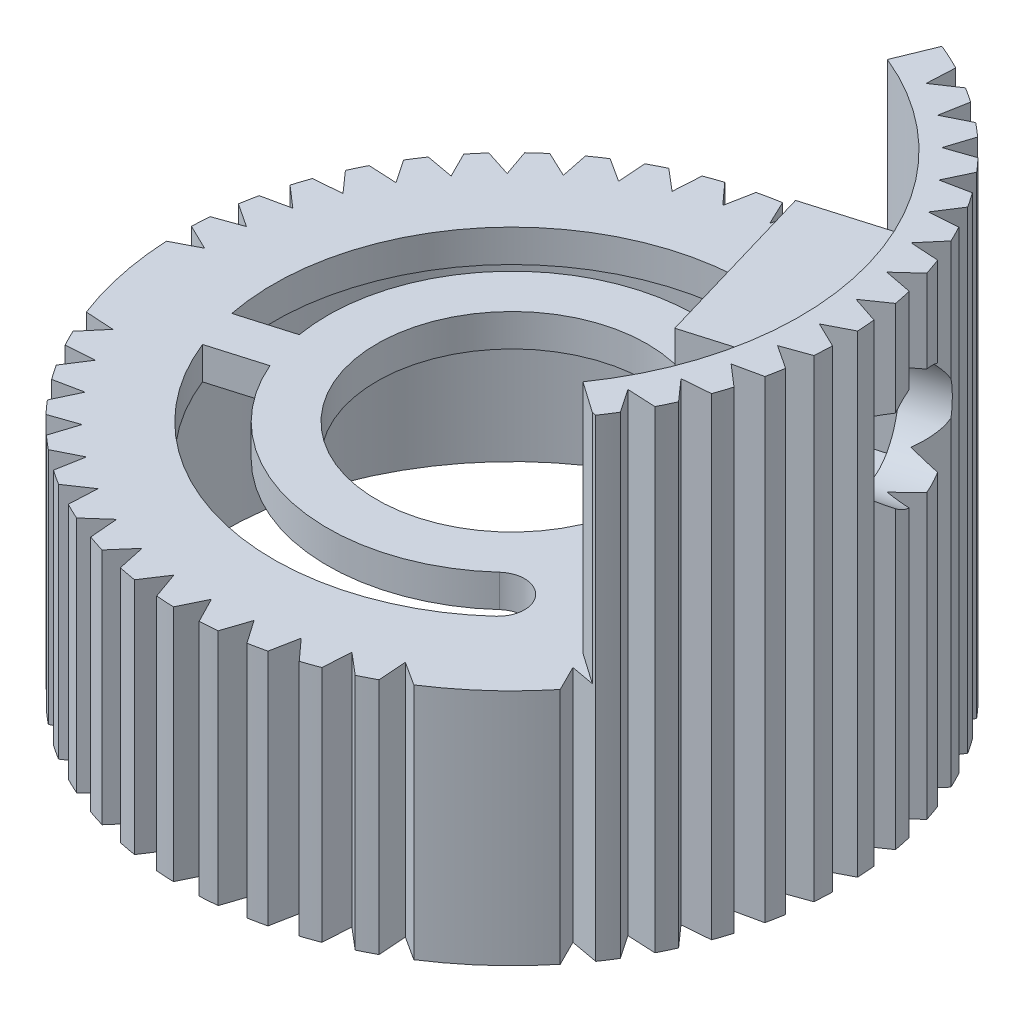
from build123d import *

# Parameters (mm, degrees)
SKETCH1_R                             = 26.631966011
BOSS_EXTRUDE1_DEPTH                   = 45.77
SKETCH3_R                             = 5
CUT_EXTRUDE1_DEPTH                    = 28.64
SKETCH9_W                             = 16.5
SKETCH9_H                             = 18.25
SKETCH9_W_2                           = 13.5
SKETCH9_H_2                           = 15.25
BOSS_EXTRUDE8_DEPTH                   = 10
BOSS_EXTRUDE9_START                   = 3
SKETCH11_R                            = 26.631966011
SKETCH11_R_2                          = 12.5
BOSS_EXTRUDE9_DEPTH                   = 3
CUT_EXTRUDE2_DEPTH                    = 57
CUT_EXTRUDE3_DEPTH                    = 57
BOSS_EXTRUDE11_REACH                  = 76.412
BOSS_EXTRUDE11_END_RADIUS             = 22.065
SKETCH14_W                            = 4
SKETCH14_H                            = 3
BOSS_EXTRUDE11_DIRECTION_2_REACH      = 76.412
BOSS_EXTRUDE11_DIRECTION_2_END_RADIUS = 17.065
SKETCH16_R                            = 53.532078291
CUT_EXTRUDE5_DEPTH                    = 2


with BuildPart() as part:
    # Sketch1 → Boss-Extrude1 (new body)
    with BuildSketch(Plane(origin=(0, 0, 0), x_dir=(1, 0, 0), z_dir=(0, 1, 0))):
        with BuildLine():
            Line((-3.984261156, 27.848398027), (-3.155526874, 30.336328812))
            ThreePointArc((-3.155526874, 30.336328812), (-2.335703763, 30.410437264), (-1.5141793, 30.462394497))
            Line((-1.5141793, 30.462394497), (-0.315230151, 28.130201914))
            Line((-0.315230151, 28.130201914), (0.831154566, 30.48867707))
            ThreePointArc((0.831154566, 30.48867707), (1.65363686, 30.455143124), (2.474914637, 30.399425407))
            Line((2.474914637, 30.399425407), (3.359194573, 27.930690283))
            Line((3.359194573, 27.930690283), (4.803614875, 30.119355554))
            ThreePointArc((4.803614875, 30.119355554), (9.479661295, 28.989418191), (13.919878882, 27.138300594))
            Line((13.919878882, 27.138300594), (13.792102919, 24.51908612))
            Line((13.792102919, 24.51908612), (15.964140245, 25.988394149))
            ThreePointArc((15.964140245, 25.988394149), (16.659663243, 25.548112068), (17.343051232, 25.089220567))
            Line((17.343051232, 25.089220567), (16.874492259, 22.509091617))
            Line((16.874492259, 22.509091617), (19.21973095, 23.682321883))
            ThreePointArc((19.21973095, 23.682321883), (19.851835217, 23.155022565), (20.469479277, 22.610856977))
            Line((20.469479277, 22.610856977), (19.668154402, 20.113960352))
            Line((19.668154402, 20.113960352), (22.146466743, 20.971038467))
            ThreePointArc((22.146466743, 20.971038467), (22.704336831, 20.365744156), (23.245668935, 19.745615304))
            Line((23.245668935, 19.745615304), (22.125289014, 17.374673686))
            Line((22.125289014, 17.374673686), (24.69427034, 17.900934736))
            ThreePointArc((24.69427034, 17.900934736), (25.168360968, 17.228002177), (25.624118803, 16.542520632))
            Line((25.624118803, 16.542520632), (24.203853841, 14.338101571))
            Line((24.203853841, 14.338101571), (26.8195481, 14.52454104))
            ThreePointArc((26.8195481, 14.52454104), (27.201747469, 13.795484281), (27.564132913, 13.056378805))
            Line((27.564132913, 13.056378805), (25.868284062, 11.0562006))
            Line((25.868284062, 11.0562006), (28.485935925, 10.899628442))
            ThreePointArc((28.485935925, 10.899628442), (28.769704511, 10.126921824), (29.032517063, 9.346838694))
            Line((29.032517063, 9.346838694), (27.090100815, 7.585125008))
            Line((27.090100815, 7.585125008), (29.664921456, 7.088220232))
            ThreePointArc((29.664921456, 7.088220232), (29.845403904, 6.285084953), (30.00414677, 5.47737158))
            Line((30.00414677, 5.47737158), (27.848398476, 3.984265861))
            Line((27.848398476, 3.984265861), (30.336331931, 3.15553069))
            ThreePointArc((30.336331931, 3.15553069), (30.410440131, 2.33570859), (30.462397167, 1.514185147))
            Line((30.462397167, 1.514185147), (28.130202362, 0.315234856))
            Line((28.130202362, 0.315234856), (30.488679348, -0.83115075))
            ThreePointArc((30.488679348, -0.83115075), (30.455145268, -1.653632314), (30.399427457, -2.474909359))
            Line((30.399427457, -2.474909359), (27.930690731, -3.359189868))
            Line((27.930690731, -3.359189868), (30.11935702, -4.803610841))
            ThreePointArc((30.11935702, -4.803610841), (29.97875441, -5.614679004), (29.81631507, -6.421657392))
            Line((29.81631507, -6.421657392), (27.253277282, -6.976137886))
            Line((27.253277282, -6.976137886), (29.234684181, -8.693879674))
            ThreePointArc((29.234684181, -8.693879674), (28.989418755, -9.479656851), (28.723037229, -10.258528973))
            Line((28.723037229, -10.258528973), (26.109552746, -10.473722214))
            Line((26.109552746, -10.473722214), (27.849797859, -12.435393664))
            ThreePointArc((27.849797859, -12.435393664), (27.504066132, -13.182434995), (27.138300238, -13.919874138))
            Line((27.138300238, -13.919874138), (24.519086569, -13.792098214))
            Line((24.519086569, -13.792098214), (25.988393872, -15.964134468))
            ThreePointArc((25.988393872, -15.964134468), (25.548111361, -16.659657866), (25.089219408, -17.343046235))
            Line((25.089219408, -17.343046235), (22.509092066, -16.874487554))
            Line((22.509092066, -16.874487554), (23.682321388, -19.219724361))
            ThreePointArc((23.682321388, -19.219724361), (20.365742572, -22.704330231), (16.542517807, -25.624111989))
            Line((16.542517807, -25.624111989), (14.33810202, -24.203849136))
            Line((14.33810202, -24.203849136), (14.524541185, -26.819539129))
            ThreePointArc((14.524541185, -26.819539129), (13.795482869, -27.201739208), (13.056375797, -27.564125279))
            Line((13.056375797, -27.564125279), (11.056201049, -25.868279357))
            Line((11.056201049, -25.868279357), (10.899629182, -28.485926359))
            ThreePointArc((10.899629182, -28.485926359), (10.126920725, -28.76969554), (9.346835723, -29.032508588))
            Line((9.346835723, -29.032508588), (7.585125457, -27.09009611))
            Line((7.585125457, -27.09009611), (7.0882217, -29.66491147))
            ThreePointArc((7.0882217, -29.66491147), (6.285084339, -29.845394329), (5.477368862, -30.004137493))
            Line((5.477368862, -30.004137493), (3.984266309, -27.848393771))
            Line((3.984266309, -27.848393771), (3.15553297, -30.336321728))
            ThreePointArc((3.15553297, -30.336321728), (2.3357086, -30.410430097), (1.51418288, -30.462387181))
            Line((1.51418288, -30.462387181), (0.315235305, -28.130197658))
            Line((0.315235305, -28.130197658), (-0.831147629, -30.488669145))
            ThreePointArc((-0.831147629, -30.488669145), (-1.653631581, -30.455134954), (-2.474911005, -30.399416902))
            Line((-2.474911005, -30.399416902), (-3.35918942, -27.930686027))
            Line((-3.35918942, -27.930686027), (-4.803606908, -30.119347035))
            ThreePointArc((-4.803606908, -30.119347035), (-5.614677501, -29.978744012), (-6.421658293, -29.816304126))
            Line((-6.421658293, -29.816304126), (-6.976137437, -27.253272577))
            Line((-6.976137437, -27.253272577), (-8.693875013, -29.234674617))
            ThreePointArc((-8.693875013, -29.234674617), (-9.479654581, -28.989408474), (-10.258529053, -28.723026103))
            Line((-10.258529053, -28.723026103), (-10.473721765, -26.109548042))
            Line((-10.473721765, -26.109548042), (-12.435388408, -27.84978889))
            ThreePointArc((-12.435388408, -27.84978889), (-13.182432016, -27.504056163), (-13.919873378, -27.138289149))
            Line((-13.919873378, -27.138289149), (-13.792097766, -24.519081864))
            Line((-13.792097766, -24.519081864), (-15.964128792, -25.988385631))
            ThreePointArc((-15.964128792, -25.988385631), (-16.659654283, -25.548101878), (-17.343044673, -25.089208572))
            Line((-17.343044673, -25.089208572), (-16.874487106, -22.509087361))
            Line((-16.874487106, -22.509087361), (-19.219718467, -23.68231396))
            ThreePointArc((-19.219718467, -23.68231396), (-19.851825173, -23.155012543), (-20.469471557, -22.610844724))
            Line((-20.469471557, -22.610844724), (-19.668149248, -20.113956096))
            Line((-19.668149248, -20.113956096), (-22.146453419, -20.971031386))
            ThreePointArc((-22.146453419, -20.971031386), (-22.704325784, -20.365734574), (-23.245660027, -19.745603103))
            Line((-23.245660027, -19.745603103), (-22.125283861, -17.374669429))
            Line((-22.125283861, -17.374669429), (-24.694256422, -17.900928684))
            ThreePointArc((-24.694256422, -17.900928684), (-25.168349066, -17.227993282), (-25.62410876, -16.542508787))
            Line((-25.62410876, -16.542508787), (-24.203848687, -14.338097315))
            Line((-24.203848687, -14.338097315), (-26.819533875, -14.524536138))
            ThreePointArc((-26.819533875, -14.524536138), (-27.201734918, -13.79547627), (-27.564121868, -13.056367599))
            Line((-27.564121868, -13.056367599), (-25.868278909, -11.056196344))
            Line((-25.868278909, -11.056196344), (-28.4859217, -10.899624729))
            ThreePointArc((-28.4859217, -10.899624729), (-29.845390828, -6.285079097), (-30.462384511, -1.514177033))
            Line((-30.462384511, -1.514177033), (-28.130197209, -0.3152306))
            Line((-28.130197209, -0.3152306), (-30.488666867, 0.831151445))
            ThreePointArc((-30.488666867, 0.831151445), (-30.455132809, 1.653636127), (-30.399414852, 2.474916284))
            Line((-30.399414852, 2.474916284), (-27.930685578, 3.359194124))
            Line((-27.930685578, 3.359194124), (-30.119345569, 4.803610941))
            ThreePointArc((-30.119345569, 4.803610941), (-29.978742638, 5.614681962), (-29.816302822, 6.421663183))
            Line((-29.816302822, 6.421663183), (-27.253272129, 6.976142142))
            Line((-27.253272129, 6.976142142), (-29.23467388, 8.693879467))
            ThreePointArc((-29.23467388, 8.693879467), (-28.989407866, 9.479659161), (-28.72302562, 10.258533761))
            Line((-28.72302562, 10.258533761), (-26.109547593, 10.47372647))
            Line((-26.109547593, 10.47372647), (-27.849788746, 12.435393457))
            ThreePointArc((-27.849788746, 12.435393457), (-27.504056265, 13.182436908), (-27.138289505, 13.919878122))
            Line((-27.138289505, 13.919878122), (-24.519081415, 13.792102471))
            Line((-24.519081415, 13.792102471), (-25.988385908, 15.964134569))
            ThreePointArc((-25.988385908, 15.964134569), (-25.548102584, 16.65965966), (-25.089209731, 17.34304967))
            Line((-25.089209731, 17.34304967), (-22.509086912, 16.87449181))
            Line((-22.509086912, 16.87449181), (-23.682314454, 19.219725057))
            ThreePointArc((-23.682314454, 19.219725057), (-23.155013707, 19.851831175), (-22.610846592, 20.469477005))
            Line((-22.610846592, 20.469477005), (-20.113955647, 19.668153953))
            Line((-20.113955647, 19.668153953), (-20.97103188, 22.14646085))
            ThreePointArc((-20.97103188, 22.14646085), (-20.36573602, 22.704332508), (-19.745605539, 23.245666095))
            Line((-19.745605539, 23.245666095), (-17.374668981, 22.125288565))
            Line((-17.374668981, 22.125288565), (-17.90092896, 24.694264665))
            ThreePointArc((-17.90092896, 24.694264665), (-17.227994811, 25.168356561), (-16.542511612, 25.624115574))
            Line((-16.542511612, 25.624115574), (-14.338096867, 24.203853392))
            Line((-14.338096867, 24.203853392), (-14.524535993, 26.819542846))
            ThreePointArc((-14.524535993, 26.819542846), (-13.795477682, 27.20174318), (-13.056370606, 27.564129503))
            Line((-13.056370606, 27.564129503), (-11.056195896, 25.868283613))
            Line((-11.056195896, 25.868283613), (-10.89962399, 28.485931265))
            ThreePointArc((-10.89962399, 28.485931265), (-10.126915935, 28.769700534), (-9.346831335, 29.032513688))
            Line((-9.346831335, 29.032513688), (-7.585120303, 27.090100366))
            Line((-7.585120303, 27.090100366), (-7.088216199, 29.664917524))
            ThreePointArc((-7.088216199, 29.664917524), (-6.06936901, 29.890013635), (-5.043418528, 30.08012798))
            Line((-5.043418528, 30.08012798), (-3.984261156, 27.848398027))
        make_face()
        with Locations(Location((2.577e-06, 2.128e-06, 0), (0, 0, 270))):
            Circle(SKETCH1_R, mode=Mode.SUBTRACT)
    extrude(amount=BOSS_EXTRUDE1_DEPTH)

    # Sketch3 → Cut-Extrude1 (cut)
    with BuildSketch(Plane(origin=(35.495871095, 0, -10.442392938), x_dir=(-0.28222679131648654, 0, -0.9593477149934744), z_dir=(0.9593477149934744, 0, -0.28222679131648654))):
        with Locations((1.938e-06, 33.1475)):
            Circle(SKETCH3_R)
    extrude(amount=-CUT_EXTRUDE1_DEPTH, mode=Mode.SUBTRACT)

    # Sketch9 → Boss-Extrude8 (add)
    with BuildSketch(Plane(origin=(25.549318686, 0, -7.516255181), x_dir=(0.2822267913164864, 0, 0.9593477149934744), z_dir=(-0.9593477149934744, 0, 0.2822267913164864))):
        with Locations((-1.938e-06, 33.1475)):
            Rectangle(SKETCH9_W, SKETCH9_H)
        with Locations((-1.938e-06, 33.1475)):
            Rectangle(SKETCH9_W_2, SKETCH9_H_2, mode=Mode.SUBTRACT)
    extrude(amount=BOSS_EXTRUDE8_DEPTH)

    # Sketch11 → Boss-Extrude9 (add)
    with BuildSketch(Plane.XZ.offset(-24.0225).offset(BOSS_EXTRUDE9_START)):
        with Locations(Location((2.577e-06, -2.128e-06, 0), (0, 0, 325.560988293))):
            Circle(SKETCH11_R)
        with Locations(Location((2.577e-06, -2.128e-06, 0), (0, 0, 270))):
            Circle(SKETCH11_R_2, mode=Mode.SUBTRACT)
    extrude(amount=-BOSS_EXTRUDE9_DEPTH)

    # Sketch12 → Cut-Extrude2 (cut)
    with BuildSketch(Plane(origin=(0, 24.0225, 0), x_dir=(1, 0, 0), z_dir=(0, 1, 0))):
        with BuildLine():
            Line((2.577e-06, 2.128e-06), (10.085527594, 24.648405702))
            Line((10.085527594, 24.648405702), (17.346679097, 42.394213914))
            ThreePointArc((17.346679097, 42.394213914), (-43.943740033, -12.927637435), (37.540058708, -26.247294207))
            Line((37.540058708, -26.247294207), (21.826153241, -15.260429085))
            Line((21.826153241, -15.260429085), (2.577e-06, 2.128e-06))
        make_face()
    extrude(amount=CUT_EXTRUDE2_DEPTH, mode=Mode.SUBTRACT)

    # Sketch13 → Cut-Extrude3 (cut)
    with BuildSketch(Plane(origin=(0, 24.0225, 0), x_dir=(1, 0, 0), z_dir=(0, 1, 0))):
        with BuildLine():
            ThreePointArc((4.004392841, 21.698598479), (-21.222513423, -6.038958018), (14.828345589, -16.339657248))
            ThreePointArc((14.828345589, -16.339657248), (14.999580164, -12.808272431), (11.468195348, -12.637037856))
            ThreePointArc((11.468195348, -12.637037856), (-16.413423008, -4.670510217), (3.096985122, 16.781626725))
            ThreePointArc((3.096985122, 16.781626725), (6.009174859, 18.786408743), (4.004392841, 21.698598479))
        make_face()
    extrude(amount=-CUT_EXTRUDE3_DEPTH, mode=Mode.SUBTRACT)

    # Boss-Extrude11: up to this cylinder (the profile starts inside it)
    boss_extrude11_end = Plane(origin=(2.577e-06, 22.5225, -2.128e-06), z_dir=(0, 1, 0)) * Cylinder(BOSS_EXTRUDE11_END_RADIUS, 197.954, mode=Mode.PRIVATE)
    # Sketch14 → Boss-Extrude11 (add, up to the surface)
    with BuildSketch(Plane(origin=(-16.371265809, 0, 4.816199327), x_dir=(0.2822267913164864, 0, 0.9593477149934744), z_dir=(-0.9593477149934744, 0, 0.2822267913164864)), mode=Mode.PRIVATE) as boss_extrude11_sk1:
        with Locations((0, 22.5225)):
            Rectangle(SKETCH14_W, SKETCH14_H)
    boss_extrude11_tool1 = extrude(boss_extrude11_sk1.sketch, amount=BOSS_EXTRUDE11_REACH, mode=Mode.PRIVATE) & boss_extrude11_end
    add(boss_extrude11_tool1.solids().sort_by_distance((-16.371266, 22.5225, 4.816199))[0])

    # Boss-Extrude11 direction 2: up to this cylinder (the profile starts outside it)
    boss_extrude11_direction_2_end = Plane(origin=(2.577e-06, 22.5225, -2.128e-06), z_dir=(0, 1, 0)) * Cylinder(BOSS_EXTRUDE11_DIRECTION_2_END_RADIUS, 187.954, mode=Mode.PRIVATE)
    # Sketch14 → Boss-Extrude11 direction 2 (add, up to the surface)
    with BuildSketch(Plane(origin=(-16.371265809, 0, 4.816199327), x_dir=(0.2822267913164864, 0, 0.9593477149934744), z_dir=(-0.9593477149934744, 0, 0.2822267913164864)), mode=Mode.PRIVATE) as boss_extrude11_direction_2_sk1:
        with Locations((0, 22.5225)):
            Rectangle(SKETCH14_W, SKETCH14_H)
    boss_extrude11_direction_2_tool1 = extrude(boss_extrude11_direction_2_sk1.sketch, amount=-BOSS_EXTRUDE11_DIRECTION_2_REACH, mode=Mode.PRIVATE) - boss_extrude11_direction_2_end
    add(boss_extrude11_direction_2_tool1.solids().sort_by_distance((-16.371266, 22.5225, 4.816199))[0])
    add(boss_extrude11_direction_2_tool1.solids().sort_by_distance((-16.371266, 22.5225, 4.816199))[1])

    # Sketch16 → Cut-Extrude5 (cut)
    with BuildSketch(Plane.XZ):
        Circle(SKETCH16_R)
    extrude(amount=-CUT_EXTRUDE5_DEPTH, mode=Mode.SUBTRACT)


solid = part.part
